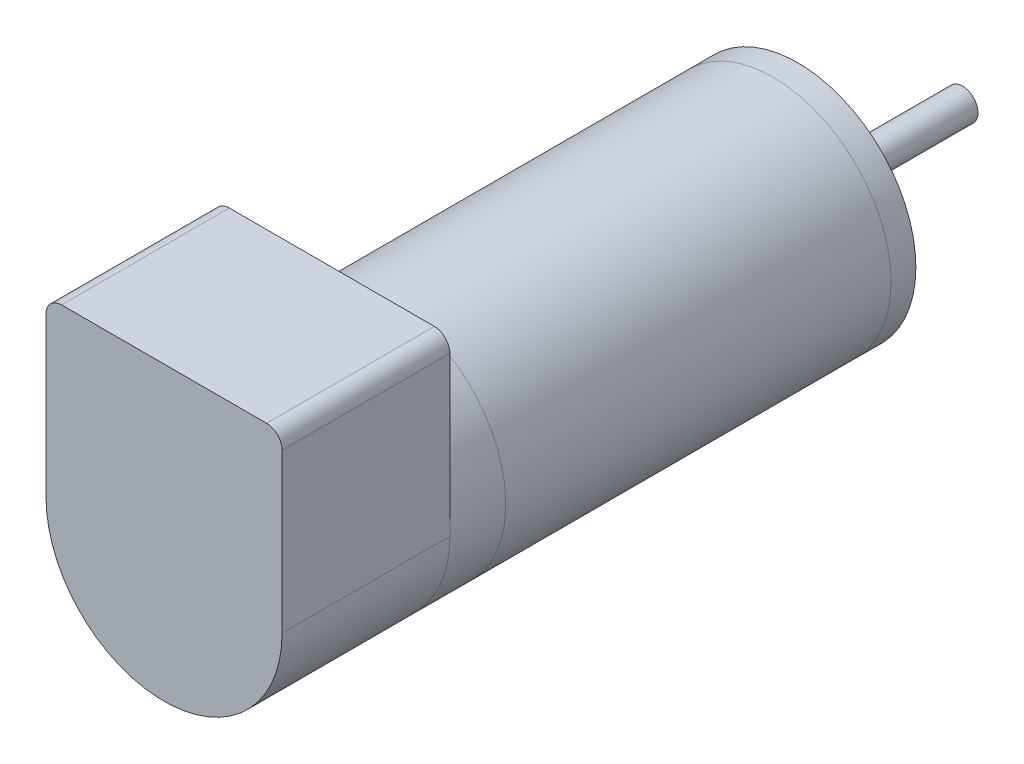
from build123d import *

# Parameters (mm, degrees)
BOSS_EXTRUDE1_DEPTH = 27
SKETCH4_R           = 1.5
CUT_EXTRUDE1_DEPTH  = 10


with BuildPart() as part:
    # Sketch1 → Revolve1 (revolve)
    with BuildSketch(Plane(origin=(0, 0, 0), x_dir=(0, 0, -1), z_dir=(1, 0, 0)), mode=Mode.PRIVATE) as revolve1_sk:
        Polygon((0, 0), (0, 19), (75, 19), (75, 6.25), (76.5, 6.25), (76.5, 2.5), (101.5, 2.5), (101.5, 0), align=None)
    revolve(revolve1_sk.sketch.rotate(Axis((0, 0, 0), (0, 0, -1)), 90), axis=Axis((0, 0, 0), (0, 0, -1)))

    # Sketch2 → Boss-Extrude1 (add)
    with BuildSketch(Plane.XY):
        with BuildLine():
            Line((-19, 0), (-19, 25.5))
            ThreePointArc((-19, 25.5), (-18.267766953, 27.267766953), (-16.5, 28))
            Line((-16.5, 28), (16.5, 28))
            ThreePointArc((16.5, 28), (18.267766953, 27.267766953), (19, 25.5))
            Line((19, 25.5), (19, 0))
            ThreePointArc((19, 0), (0, -19), (-19, 0))
        make_face()
    extrude(amount=BOSS_EXTRUDE1_DEPTH)

    # Sketch4 → Cut-Extrude1 (cut)
    with BuildSketch(Plane(origin=(0, 0, -75), x_dir=(-1, 0, 0), z_dir=(0, 0, -1))):
        with Locations((-8.838834765, 8.838834765)):
            Circle(SKETCH4_R)
        with Locations((8.838834765, 8.838834765)):
            Circle(SKETCH4_R)
        with Locations((8.838834765, -8.838834765)):
            Circle(SKETCH4_R)
        with Locations((-8.838834765, -8.838834765)):
            Circle(SKETCH4_R)
    extrude(amount=-CUT_EXTRUDE1_DEPTH, mode=Mode.SUBTRACT)


solid = part.part
